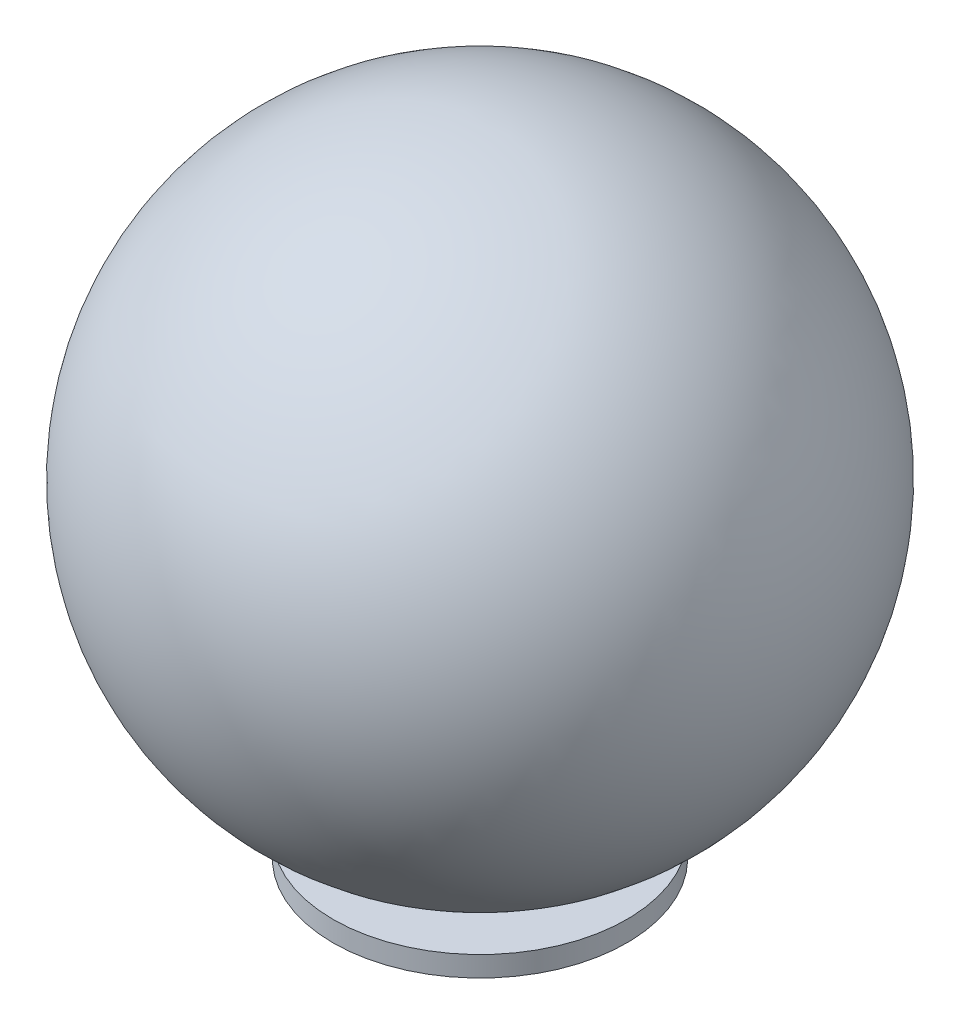
from build123d import *

# Parameters (mm, degrees)
SKETCH2_R           = 72.086406649
BOSS_EXTRUDE1_DEPTH = 10


with BuildPart() as part:
    # Sketch1 → Revolve1 (revolve)
    with BuildSketch(Plane.XY):
        with BuildLine():
            Line((0, 150.456780159), (0, 144.678208671))
            ThreePointArc((0, 144.678208671), (-144.678208671, 0), (0, -144.678208671))
            Line((0, -144.678208671), (0, -150.456780159))
            ThreePointArc((0, -150.456780159), (-150.456780159, 0), (0, 150.456780159))
        make_face()
    revolve(axis=Axis((0, 150.456780159, 0), (0, -1, 0)))


with BuildPart() as body_2:
    # Sketch2 → Boss-Extrude1 (new body)
    with BuildSketch(Plane(origin=(0, -151, 0), x_dir=(1, 0, 0), z_dir=(0, 1, 0))):
        with Locations(Location((0, 0, 0), (0, 0, 270))):
            Circle(SKETCH2_R)
    extrude(amount=-BOSS_EXTRUDE1_DEPTH)


solid = Compound([part.part, body_2.part])
